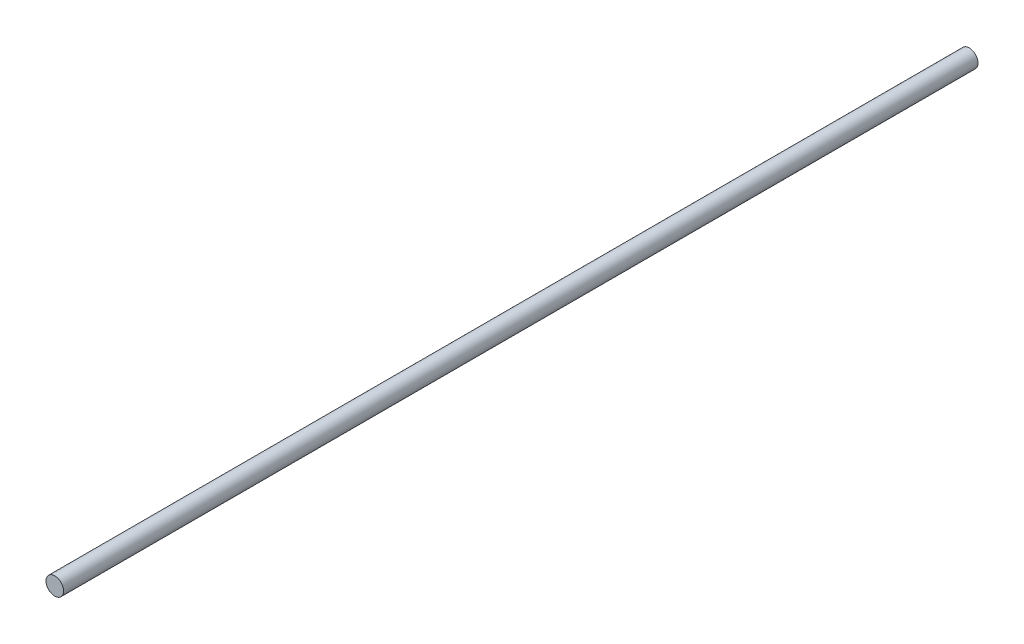
from build123d import *

# Parameters (mm, degrees)
ESQUISSE1_R        = 4
BOSS_EXTRU_1_DEPTH = 416


with BuildPart() as part:
    # Esquisse1 → Boss.-Extru.1 (new body)
    with BuildSketch(Plane.XY):
        with Locations(Location((0, 0, 0), (0, 0, 180))):
            Circle(ESQUISSE1_R)
    extrude(amount=BOSS_EXTRU_1_DEPTH)


solid = part.part
